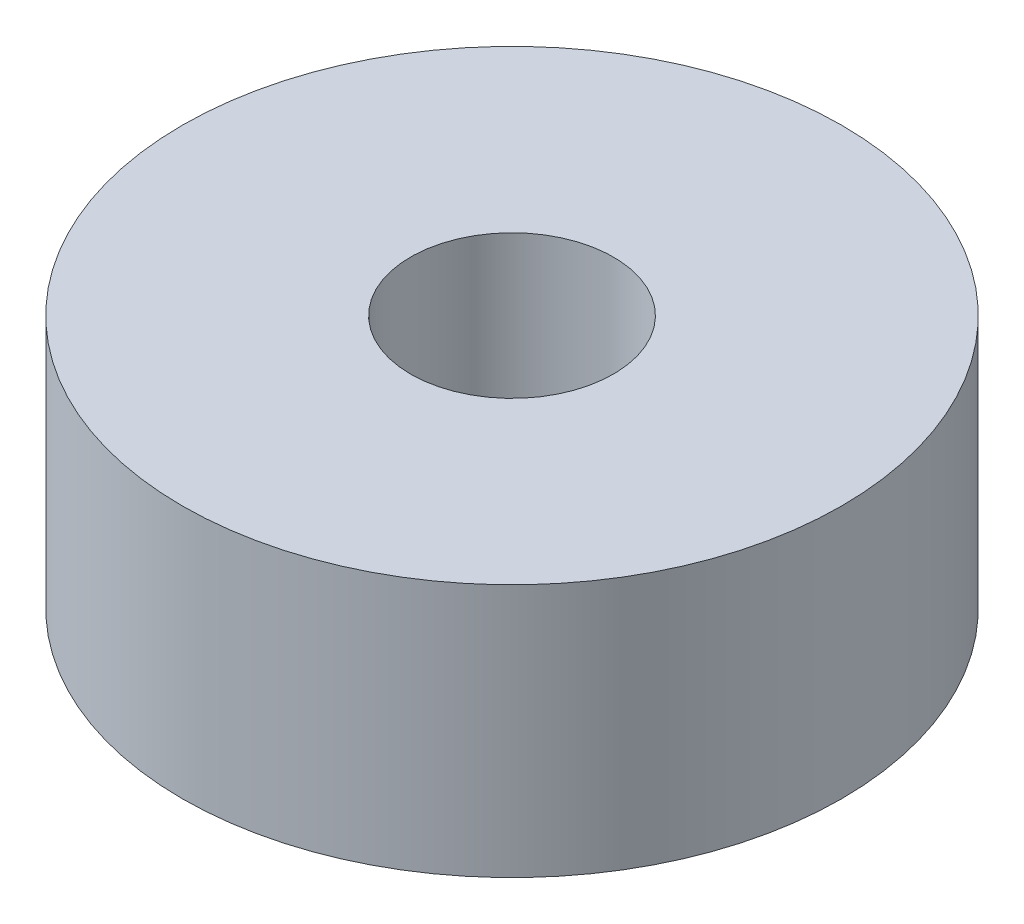
from build123d import *

# Parameters (mm, degrees)
SKETCH_1_R      = 6.5
SKETCH_1_R_2    = 2
EXTRUDE_1_DEPTH = 5


with BuildPart() as part:
    # 草图1 → 凸台-拉伸1 (new body)
    with BuildSketch(Plane(origin=(0, 0, 0), x_dir=(1, 0, 0), z_dir=(0, 1, 0))):
        with Locations(Location((0, 0, 0), (0, 0, 270))):
            Circle(SKETCH_1_R)
        with Locations(Location((0, 0, 0), (0, 0, 270))):
            Circle(SKETCH_1_R_2, mode=Mode.SUBTRACT)
    extrude(amount=EXTRUDE_1_DEPTH)


solid = part.part
